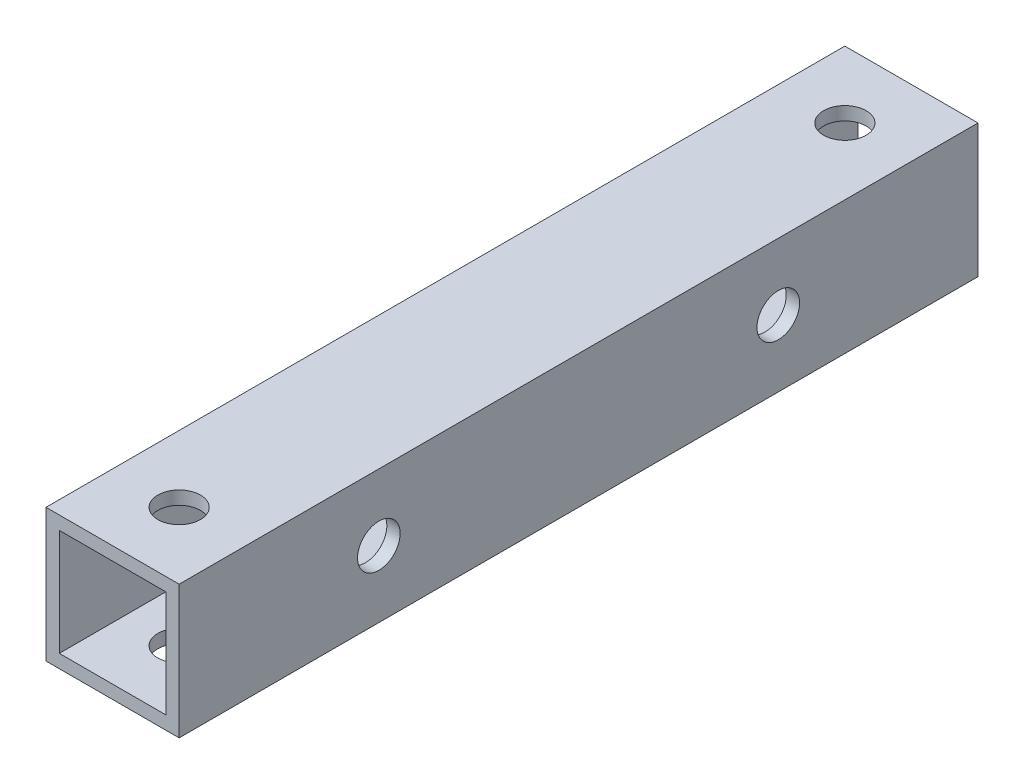
from build123d import *

# Parameters (mm, degrees)
SKETCH_1_W          = 10
SKETCH_1_H          = 10
SKETCH_1_W_2        = 8
SKETCH_1_H_2        = 8
EXTRUDE_1_DEPTH     = 30
SKETCH_2_R          = 1.6
CUT_EXTRUDE_1_DEPTH = 33.015621187
SKETCH_3_R          = 1.6
CUT_EXTRUDE_2_DEPTH = 33.015621187


with BuildPart() as part:
    # ｽｹｯﾁ1 → 押し出し-薄板1 (new, symmetric)
    with BuildSketch(Plane.XY):
        Rectangle(SKETCH_1_W, SKETCH_1_H)
        Rectangle(SKETCH_1_W_2, SKETCH_1_H_2, mode=Mode.SUBTRACT)
    extrude(amount=EXTRUDE_1_DEPTH, both=True)

    # ｽｹｯﾁ2 → ｶｯﾄ - 押し出し1 (cut, symmetric)
    with BuildSketch(Plane(origin=(0, 5, 0), x_dir=(1, 0, 0), z_dir=(0, 1, 0))):
        with Locations(Location((0, 25, 0), (0, 0, 270))):
            Circle(SKETCH_2_R)
    cut_extrude_1 = extrude(amount=CUT_EXTRUDE_1_DEPTH, both=True, mode=Mode.SUBTRACT)

    # ｽｹｯﾁ3 → ｶｯﾄ - 押し出し2 (cut, symmetric)
    with BuildSketch(Plane.ZY.offset(5)):
        with Locations((-15, 0)):
            Circle(SKETCH_3_R)
    cut_extrude_2 = extrude(amount=CUT_EXTRUDE_2_DEPTH, both=True, mode=Mode.SUBTRACT)

    # ﾐﾗｰ1: ｶｯﾄ - 押し出し1, ｶｯﾄ - 押し出し2 across plane
    add(cut_extrude_1.mirror(Plane.XY), mode=Mode.SUBTRACT)
    add(cut_extrude_2.mirror(Plane.XY), mode=Mode.SUBTRACT)


solid = part.part
